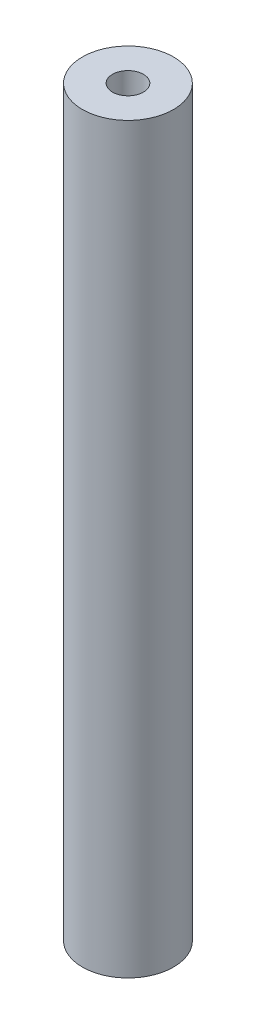
from build123d import *

# Parameters (mm, degrees)
SKETCH1_R           = 14.725
SKETCH1_R_2         = 5
BOSS_EXTRUDE1_DEPTH = 240


with BuildPart() as part:
    # Sketch1 → Boss-Extrude1 (new body)
    with BuildSketch(Plane(origin=(0, 0, 0), x_dir=(1, 0, 0), z_dir=(0, 1, 0))):
        with Locations(Location((0, 0, 0), (0, 0, 270))):
            Circle(SKETCH1_R)
        with Locations(Location((0, 0, 0), (0, 0, 270))):
            Circle(SKETCH1_R_2, mode=Mode.SUBTRACT)
    extrude(amount=BOSS_EXTRUDE1_DEPTH)


solid = part.part
